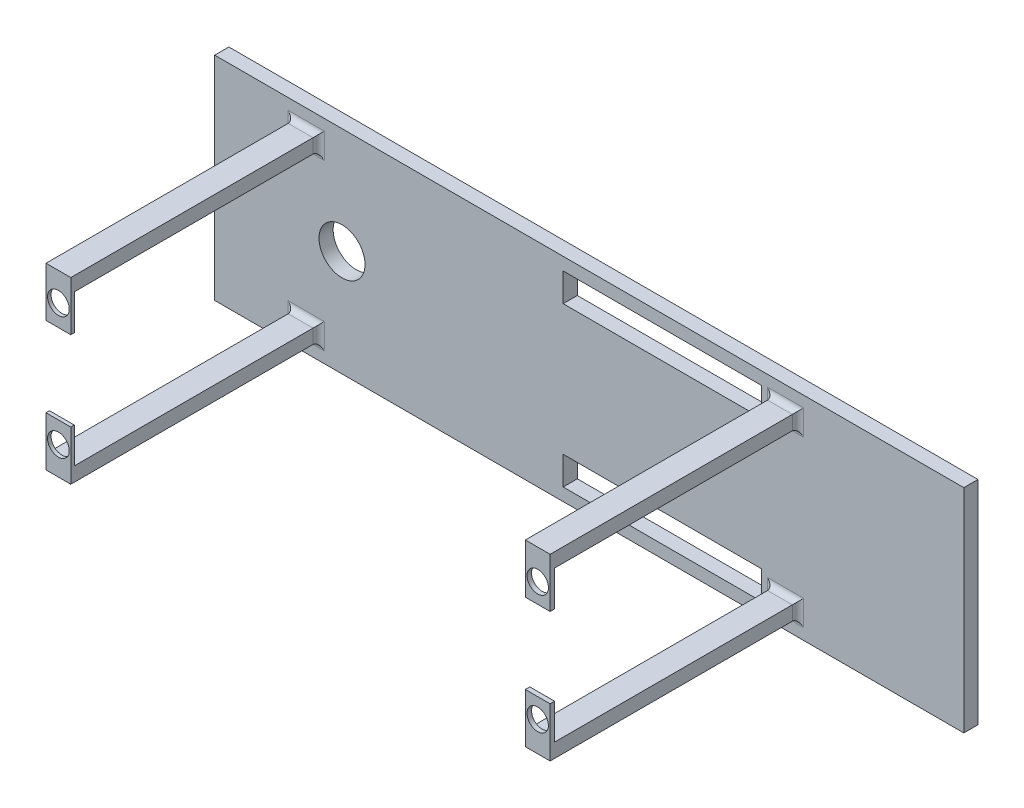
from build123d import *

# Parameters (mm, degrees)
SKETCH1_W           = 105.78
SKETCH1_H           = 30
BOSS_EXTRUDE1_DEPTH = 2
SKETCH5_W           = 3.5
SKETCH5_H           = 2
BOSS_EXTRUDE2_DEPTH = 35
SKETCH6_W           = 3.5
SKETCH6_H           = 2
BOSS_EXTRUDE3_DEPTH = 35
SKETCH7_W           = 3.5
SKETCH7_H           = 0.495515405
BOSS_EXTRUDE4_DEPTH = 5
SKETCH9_W           = 3.5
SKETCH9_H           = 0.633233513
BOSS_EXTRUDE5_DEPTH = 5
SKETCH10_R          = 1.510168907
CUT_EXTRUDE2_DEPTH  = 72
SKETCH11_R          = 1.533572267
CUT_EXTRUDE3_DEPTH  = 42
SKETCH12_R          = 3.25
CUT_EXTRUDE4_DEPTH  = 15
FILLET1_R           = 0.8
SKETCH13_W          = 28.000104313
SKETCH13_H          = 4
CUT_EXTRUDE5_DEPTH  = 10


with BuildPart() as part:
    # Sketch1 → Boss-Extrude1 (new body)
    with BuildSketch(Plane.XY):
        Rectangle(SKETCH1_W, SKETCH1_H)
    extrude(amount=BOSS_EXTRUDE1_DEPTH)

    # Sketch5 → Boss-Extrude2 (add)
    with BuildSketch(Plane.XY.offset(2)):
        with Locations((27.719609025, 11.641851008)):
            Rectangle(SKETCH5_W, SKETCH5_H)
    boss_extrude2 = extrude(amount=BOSS_EXTRUDE2_DEPTH)

    # Sketch6 → Boss-Extrude3 (add)
    with BuildSketch(Plane.XY.offset(2)):
        with Locations((-39.966011677, 11.641851008)):
            Rectangle(SKETCH6_W, SKETCH6_H)
    boss_extrude3 = extrude(amount=BOSS_EXTRUDE3_DEPTH)

    # Sketch7 → Boss-Extrude4 (add)
    with BuildSketch(Plane.XZ.offset(-10.641851008)):
        with Locations((-39.966011677, 36.752242298)):
            Rectangle(SKETCH7_W, SKETCH7_H)
    boss_extrude4 = extrude(amount=BOSS_EXTRUDE4_DEPTH)

    # Sketch9 → Boss-Extrude5 (add)
    with BuildSketch(Plane.XZ.offset(-10.641851008)):
        with Locations((27.719609025, 36.683383244)):
            Rectangle(SKETCH9_W, SKETCH9_H)
    boss_extrude5 = extrude(amount=BOSS_EXTRUDE5_DEPTH)

    # Sketch10 → Cut-Extrude2 (cut)
    with BuildSketch(Plane.XY.offset(2)):
        with Locations(Location((27.719609025, 8.420134131, 0), (0, 0, 180))):
            Circle(SKETCH10_R)
    cut_extrude2 = extrude(amount=CUT_EXTRUDE2_DEPTH, mode=Mode.SUBTRACT)

    # Sketch11 → Cut-Extrude3 (cut)
    with BuildSketch(Plane.XY.offset(2)):
        with Locations(Location((-39.966011677, 8.661839338, 0), (0, 0, 180))):
            Circle(SKETCH11_R)
    cut_extrude3 = extrude(amount=CUT_EXTRUDE3_DEPTH, mode=Mode.SUBTRACT)

    # Mirror2: Boss-Extrude2, Boss-Extrude3, Boss-Extrude4, Boss-Extrude5, Cut-Extrude2, Cut-Extrude3 across plane
    add(boss_extrude2.mirror(Plane.ZX))
    add(boss_extrude3.mirror(Plane.ZX))
    add(boss_extrude4.mirror(Plane.ZX))
    add(boss_extrude5.mirror(Plane.ZX))
    add(cut_extrude2.mirror(Plane.ZX), mode=Mode.SUBTRACT)
    add(cut_extrude3.mirror(Plane.ZX), mode=Mode.SUBTRACT)

    # Sketch12 → Cut-Extrude4 (cut)
    with BuildSketch(Plane.XY.offset(2)):
        with Locations((-34.920285351, 0)):
            Circle(SKETCH12_R)
    extrude(amount=-CUT_EXTRUDE4_DEPTH, mode=Mode.SUBTRACT)

    # Fillet1
    fillet1_edges = [part.edges().sort_by_distance(p)[0] for p in [
        (29.469609025, 11.641851008, 2),
        (27.719609025, 12.641851008, 2),
        (25.969609025, 11.641851008, 2),
        (27.719609025, 10.641851008, 2),
        (-38.216011677, 11.641851008, 2),
        (-39.966011677, 12.641851008, 2),
        (-41.716011677, 11.641851008, 2),
        (-39.966011677, 10.641851008, 2),
        (29.469609025, -11.641851008, 2),
        (27.719609025, -12.641851008, 2),
        (25.969609025, -11.641851008, 2),
        (27.719609025, -10.641851008, 2),
        (-38.216011677, -11.641851008, 2),
        (-39.966011677, -12.641851008, 2),
        (-41.716011677, -11.641851008, 2),
        (-39.966011677, -10.641851008, 2),
    ]]
    fillet(fillet1_edges, radius=FILLET1_R)

    # Sketch13 → Cut-Extrude5 (cut)
    with BuildSketch(Plane(origin=(0, 0, 0), x_dir=(-1, 0, 0), z_dir=(0, 0, -1))):
        with Locations((-10.313745058, 11.208488392)):
            Rectangle(SKETCH13_W, SKETCH13_H)
    cut_extrude5 = extrude(amount=-CUT_EXTRUDE5_DEPTH, mode=Mode.SUBTRACT)

    # Mirror3: Cut-Extrude5 across plane
    add(cut_extrude5.mirror(Plane.ZX), mode=Mode.SUBTRACT)


solid = part.part
